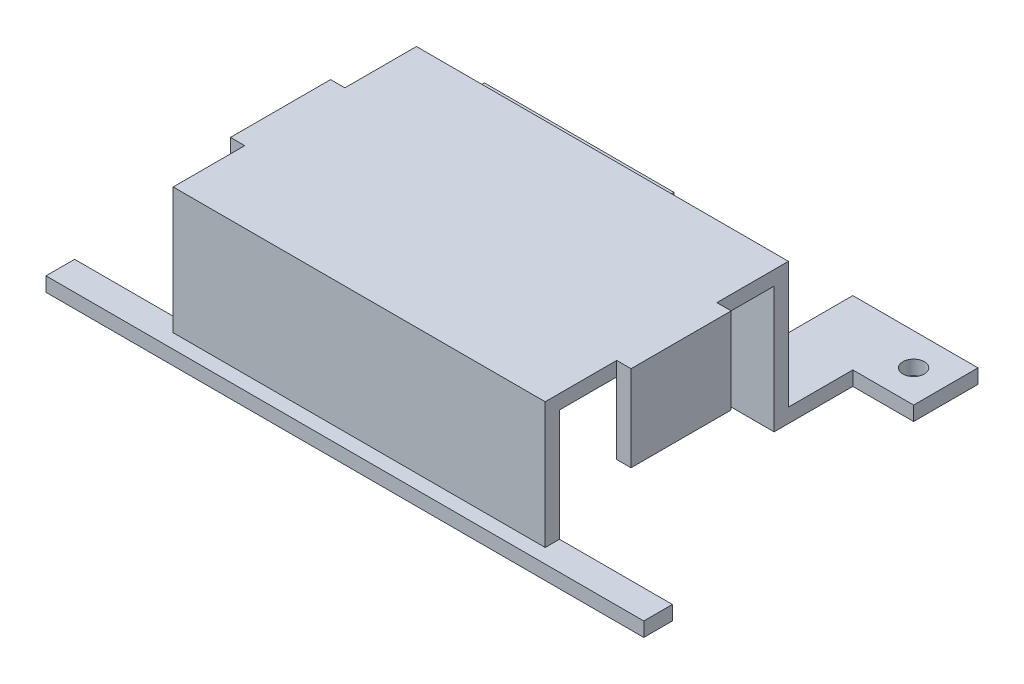
from build123d import *

# Parameters (mm, degrees)
SKETCH1_W            = 52
SKETCH1_H            = 34
BOSS_EXTRUDE1_DEPTH  = 19.65
SKETCH2_W            = 52
SKETCH2_H            = 30
CUT_EXTRUDE1_DEPTH   = 17.65
SKETCH3_W            = 9
SKETCH3_H            = 2
SKETCH3_W_2          = 18
BOSS_EXTRUDE2_DEPTH  = 18
SKETCH4_W            = 18
SKETCH4_H            = 2
BOSS_EXTRUDE3_DEPTH  = 8.5
SKETCH5_W            = 18
SKETCH5_H            = 2
BOSS_EXTRUDE4_DEPTH  = 8.5
SKETCH6_R            = 1.5
CUT_EXTRUDE2_DEPTH   = 82.705400678
SKETCH7_W            = 52
SKETCH7_H            = 2
BOSS_EXTRUDE5_DEPTH  = 2
SKETCH8_W            = 4
SKETCH8_H            = 2
BOSS_EXTRUDE6_DEPTH  = 15.78
SKETCH9_W            = 4
SKETCH9_H            = 2
BOSS_EXTRUDE7_DEPTH  = 15.78
SKETCH11_W           = 11
SKETCH11_H           = 17.65
CUT_EXTRUDE3_DEPTH   = 18
SKETCH12_W           = 9
SKETCH12_H           = 2
CUT_EXTRUDE4_DEPTH   = 8.5
SKETCH14_W           = 14
SKETCH14_H           = 2
BOSS_EXTRUDE8_DEPTH  = 2
SKETCH15_W           = 14
SKETCH15_H           = 2
BOSS_EXTRUDE9_DEPTH  = 2
SKETCH16_W           = 2
SKETCH16_H           = 14
BOSS_EXTRUDE10_DEPTH = 10


with BuildPart() as part:
    # Sketch1 → Boss-Extrude1 (new body)
    with BuildSketch(Plane(origin=(0, 0, 0), x_dir=(1, 0, 0), z_dir=(0, 1, 0))):
        with Locations((26, 17)):
            Rectangle(SKETCH1_W, SKETCH1_H)
    extrude(amount=BOSS_EXTRUDE1_DEPTH)

    # Sketch2 → Cut-Extrude1 (cut)
    with BuildSketch(Plane(origin=(0, 0, 0), x_dir=(-1, 0, 0), z_dir=(0, -1, 0))):
        with Locations((-26, 17)):
            Rectangle(SKETCH2_W, SKETCH2_H)
    extrude(amount=-CUT_EXTRUDE1_DEPTH, mode=Mode.SUBTRACT)

    # Sketch3 → Boss-Extrude2 (add)
    with BuildSketch(Plane(origin=(0, 0, -34), x_dir=(-1, 0, 0), z_dir=(0, 0, -1))):
        with Locations((-47.5, 1)):
            Rectangle(SKETCH3_W, SKETCH3_H)
        with Locations((-9, 1)):
            Rectangle(SKETCH3_W_2, SKETCH3_H)
    extrude(amount=BOSS_EXTRUDE2_DEPTH)

    # Sketch4 → Boss-Extrude3 (add)
    with BuildSketch(Plane(origin=(52, 0, 0), x_dir=(0, 0, -1), z_dir=(1, 0, 0))):
        with Locations((43, 1)):
            Rectangle(SKETCH4_W, SKETCH4_H)
    extrude(amount=BOSS_EXTRUDE3_DEPTH)

    # Sketch5 → Boss-Extrude4 (add)
    with BuildSketch(Plane.ZY):
        with Locations((-43, 1)):
            Rectangle(SKETCH5_W, SKETCH5_H)
    extrude(amount=BOSS_EXTRUDE4_DEPTH)

    # Sketch6 → Cut-Extrude2 (cut, through all)
    with BuildSketch(Plane(origin=(0, 2, 0), x_dir=(1, 0, 0), z_dir=(0, 1, 0))):
        with Locations(Location((56, 47.5, 0), (0, 0, 270))):
            Circle(SKETCH6_R)
        with Locations(Location((-4, 47.5, 0), (0, 0, 270))):
            Circle(SKETCH6_R)
    extrude(amount=-CUT_EXTRUDE2_DEPTH, mode=Mode.SUBTRACT)

    # Sketch7 → Boss-Extrude5 (add)
    with BuildSketch(Plane.XY):
        with Locations((26, 1)):
            Rectangle(SKETCH7_W, SKETCH7_H)
    extrude(amount=BOSS_EXTRUDE5_DEPTH)

    # Sketch8 → Boss-Extrude6 (add)
    with BuildSketch(Plane.ZY):
        with Locations((0, 1)):
            Rectangle(SKETCH8_W, SKETCH8_H)
    extrude(amount=BOSS_EXTRUDE6_DEPTH)

    # Sketch9 → Boss-Extrude7 (add)
    with BuildSketch(Plane(origin=(52, 0, 0), x_dir=(0, 0, -1), z_dir=(1, 0, 0))):
        with Locations((0, 1)):
            Rectangle(SKETCH9_W, SKETCH9_H)
    extrude(amount=BOSS_EXTRUDE7_DEPTH)

    # Sketch11 → Cut-Extrude3 (cut)
    with BuildSketch(Plane.ZY.offset(8.5)):
        with Locations((-37.5, 8.825)):
            Rectangle(SKETCH11_W, SKETCH11_H)
    extrude(amount=-CUT_EXTRUDE3_DEPTH, mode=Mode.SUBTRACT)

    # Sketch12 → Cut-Extrude4 (cut)
    with BuildSketch(Plane(origin=(60.5, 0, 0), x_dir=(0, 0, -1), z_dir=(1, 0, 0))):
        with Locations((38.5, 1)):
            Rectangle(SKETCH12_W, SKETCH12_H)
    extrude(amount=-CUT_EXTRUDE4_DEPTH, mode=Mode.SUBTRACT)

    # Sketch14 → Boss-Extrude8 (add)
    with BuildSketch(Plane.ZY):
        with Locations((-17, 18.65)):
            Rectangle(SKETCH14_W, SKETCH14_H)
    extrude(amount=BOSS_EXTRUDE8_DEPTH)

    # Sketch15 → Boss-Extrude9 (add)
    with BuildSketch(Plane(origin=(52, 0, 0), x_dir=(0, 0, -1), z_dir=(1, 0, 0))):
        with Locations((17, 18.65)):
            Rectangle(SKETCH15_W, SKETCH15_H)
    extrude(amount=BOSS_EXTRUDE9_DEPTH)

    # Sketch16 → Boss-Extrude10 (add)
    with BuildSketch(Plane(origin=(0, 17.65, 0), x_dir=(-1, 0, 0), z_dir=(0, -1, 0))):
        with Locations((1, 17)):
            Rectangle(SKETCH16_W, SKETCH16_H)
        with Locations((-53, 17)):
            Rectangle(SKETCH16_W, SKETCH16_H)
    extrude(amount=BOSS_EXTRUDE10_DEPTH)


solid = part.part
